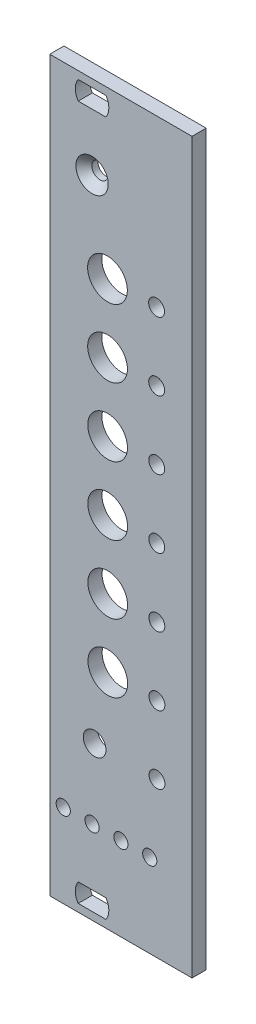
from build123d import *

# Parameters (mm, degrees)
MODEL_W                 = 25.06
MODEL_H                 = 128.4
MODEL_R                 = 1.25
MODEL_R_2               = 1.45
BOSS_EXTRU_1_DEPTH      = 2.5
CHANFREIN1_SIZE         = 1.4
ESQUISSE1_R             = 1.4
ESQUISSE1_R_2           = 3.5
ESQUISSE1_R_3           = 2
ENL_V_MAT_EXTRU_1_DEPTH = 131.846526893


with BuildPart() as part:
    # Model → Boss.-Extru.1 (new body)
    with BuildSketch(Plane.XY):
        with Locations((12.53, 64.2)):
            Rectangle(MODEL_W, MODEL_H)
        with Locations((2.37, 14.7)):
            Circle(MODEL_R, mode=Mode.SUBTRACT)
        with Locations((12.53, 14.7)):
            Circle(MODEL_R, mode=Mode.SUBTRACT)
        with Locations((7.45, 14.7)):
            Circle(MODEL_R, mode=Mode.SUBTRACT)
        with Locations((7.45, 113.7)):
            Circle(MODEL_R_2, mode=Mode.SUBTRACT)
        with Locations((17.61, 14.7)):
            Circle(MODEL_R, mode=Mode.SUBTRACT)
        with BuildLine():
            Line((9.895403852, 123.75), (5.004596148, 123.75))
            ThreePointArc((5.004596148, 123.75), (4.5, 125.4), (5.004596148, 127.05))
            Line((5.004596148, 127.05), (9.895403852, 127.05))
            ThreePointArc((9.895403852, 127.05), (10.4, 125.4), (9.895403852, 123.75))
        make_face(mode=Mode.SUBTRACT)
        with BuildLine():
            Line((9.895403852, 1.35), (5.004596148, 1.35))
            ThreePointArc((5.004596148, 1.35), (4.5, 3), (5.004596148, 4.65))
            Line((5.004596148, 4.65), (9.895403852, 4.65))
            ThreePointArc((9.895403852, 4.65), (10.4, 3), (9.895403852, 1.35))
        make_face(mode=Mode.SUBTRACT)
    extrude(amount=BOSS_EXTRU_1_DEPTH)

    # Chanfrein1
    chanfrein1_edges = [part.edges().sort_by_distance(p)[0] for p in [
        (6, 113.7, 2.5),
    ]]
    chamfer(chanfrein1_edges, length=CHANFREIN1_SIZE)

    # Esquisse1 → Enlèv. mat.-Extru.1 (cut, through all)
    with BuildSketch(Plane.XY.offset(2.5)):
        with Locations((18.81464069, 99.211522536)):
            Circle(ESQUISSE1_R)
        with Locations((18.826761896, 87.211528658)):
            Circle(ESQUISSE1_R)
        with Locations((18.838883102, 75.21153478)):
            Circle(ESQUISSE1_R)
        with Locations((18.851004308, 63.211540902)):
            Circle(ESQUISSE1_R)
        with Locations((18.863125514, 51.211547023)):
            Circle(ESQUISSE1_R)
        with Locations((18.875246719, 39.211553145)):
            Circle(ESQUISSE1_R)
        with Locations((18.887367925, 27.211559267)):
            Circle(ESQUISSE1_R)
        with Locations((10.16464508, 99.202785174)):
            Circle(ESQUISSE1_R_2)
        with Locations((10.176766286, 87.202791295)):
            Circle(ESQUISSE1_R_2)
        with Locations((10.188887492, 75.202797417)):
            Circle(ESQUISSE1_R_2)
        with Locations((10.201008698, 63.202803539)):
            Circle(ESQUISSE1_R_2)
        with Locations((10.213129904, 51.202809661)):
            Circle(ESQUISSE1_R_2)
        with Locations((10.225251109, 39.202815783)):
            Circle(ESQUISSE1_R_2)
        with Locations((7.900573508, 27.200461502)):
            Circle(ESQUISSE1_R_3)
    extrude(amount=-ENL_V_MAT_EXTRU_1_DEPTH, mode=Mode.SUBTRACT)


solid = part.part
